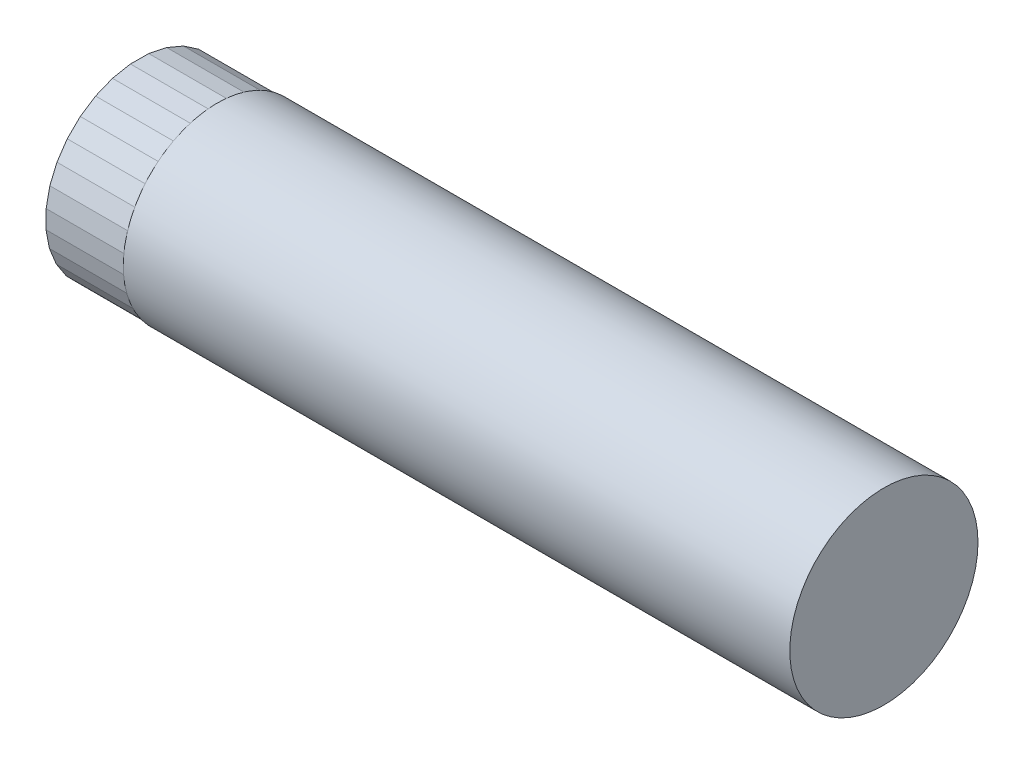
from build123d import *

# Parameters (mm, degrees)
SKETCH_1_R      = 6
EXTRUDE_1_DEPTH = 42.5
EXTRUDE_2_DEPTH = 5


with BuildPart() as part:
    # 草图1 → 凸台-拉伸1 (new body)
    with BuildSketch(Plane(origin=(0, 0, 0), x_dir=(0, 0, -1), z_dir=(1, 0, 0))):
        Circle(SKETCH_1_R)
    extrude(amount=EXTRUDE_1_DEPTH)

    # 草图2 → 凸台-拉伸2 (add)
    with BuildSketch(Plane.ZY):
        Polygon((-5.922430933, 0.537848847), (-5.913562188, -0.627894725), (-5.677438564, -1.769508656), (-5.223134161, -2.843121361), (-4.568107641, -3.807474506), (-3.737531306, -4.625508542), (-2.763323739, -5.265786878), (-1.68292319, -5.703703978), (-0.537848847, -5.922430933), (0.627894725, -5.913562188), (1.769508656, -5.677438564), (2.843121361, -5.223134161), (3.807474506, -4.568107641), (4.625508542, -3.737531306), (5.265786878, -2.763323739), (5.703703978, -1.68292319), (5.922430933, -0.537848847), (5.913562188, 0.627894725), (5.677438564, 1.769508656), (5.223134161, 2.843121361), (4.568107641, 3.807474506), (3.737531306, 4.625508542), (2.763323739, 5.265786878), (1.68292319, 5.703703978), (0.537848847, 5.922430933), (-0.627894725, 5.913562188), (-1.769508656, 5.677438564), (-2.843121361, 5.223134161), (-3.807474506, 4.568107641), (-4.625508542, 3.737531306), (-5.265786878, 2.763323739), (-5.703703978, 1.68292319), align=None)
    extrude(amount=EXTRUDE_2_DEPTH)


solid = part.part
